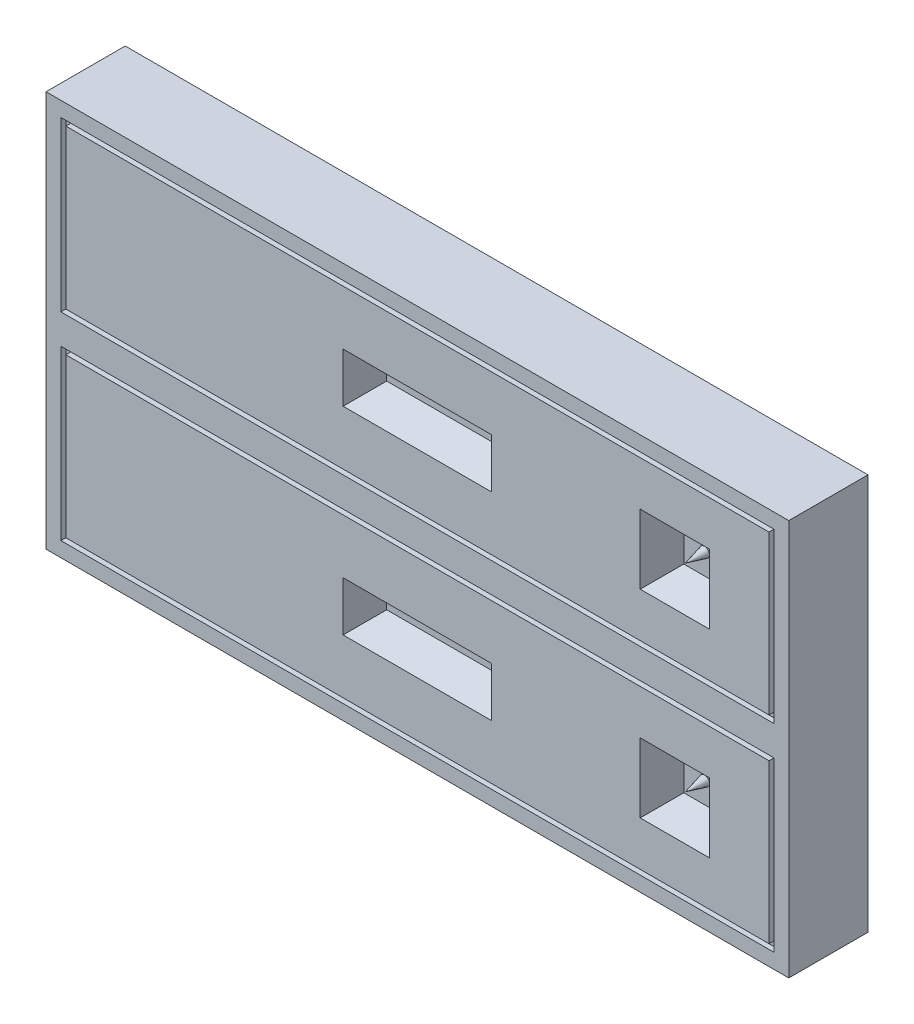
from build123d import *

# Parameters (mm, degrees)
SKETCH1_W                 = 75
SKETCH1_H                 = 40
BOSS_EXTRUDE1_DEPTH       = 8
SKETCH2_W                 = 72
SKETCH2_H                 = 17
SKETCH2_W_2               = 71
SKETCH2_H_2               = 16
CUT_EXTRUDE1_DEPTH        = 0.5
SKETCH3_W                 = 15
SKETCH3_H                 = 5
SKETCH3_W_2               = 7
SKETCH3_H_2               = 7
CUT_EXTRUDE3_DEPTH        = 3
DRAFT4_ANGLE              = 25
DRAFT5_ANGLE              = 25
DRAFT4_OF_MIRROR1_2_ANGLE = 25
DRAFT5_OF_MIRROR1_2_ANGLE = 25


with BuildPart() as part:
    # Sketch1 → Boss-Extrude1 (new body)
    with BuildSketch(Plane.XY):
        with Locations((37.5, 20)):
            Rectangle(SKETCH1_W, SKETCH1_H)
    extrude(amount=BOSS_EXTRUDE1_DEPTH)

    # Sketch2 → Cut-Extrude1 (cut)
    with BuildSketch(Plane.XY.offset(8)):
        with Locations((37.5, 10)):
            Rectangle(SKETCH2_W, SKETCH2_H)
        with Locations((37.5, 10)):
            Rectangle(SKETCH2_W_2, SKETCH2_H_2, mode=Mode.SUBTRACT)
    cut_extrude1 = extrude(amount=-CUT_EXTRUDE1_DEPTH, mode=Mode.SUBTRACT)

    # Sketch3 → Cut-Extrude3 (cut)
    with BuildSketch(Plane.XY.offset(8)):
        with Locations((37.5, 10)):
            Rectangle(SKETCH3_W, SKETCH3_H)
        with Locations((63.5, 10)):
            Rectangle(SKETCH3_W_2, SKETCH3_H_2)
    cut_extrude3 = extrude(amount=-CUT_EXTRUDE3_DEPTH, mode=Mode.SUBTRACT)

    # Draft4
    draft4_faces = [part.faces().sort_by_distance(p)[0] for p in [
        (45, 10, 6.5),
        (37.5, 7.5, 6.5),
        (30, 10, 6.5),
        (37.5, 12.5, 6.5),
    ]]
    draft(draft4_faces, Plane.XY.offset(8), DRAFT4_ANGLE)

    # Draft5
    draft5_faces = [part.faces().sort_by_distance(p)[0] for p in [
        (67, 10, 6.5),
        (63.5, 6.5, 6.5),
        (60, 10, 6.5),
        (63.5, 13.5, 6.5),
    ]]
    draft(draft5_faces, Plane.XY.offset(8), DRAFT5_ANGLE)

    # Sketch7 → Revolve2 (revolve)
    with BuildSketch(Plane(origin=(63.5, 0, 0), x_dir=(0, 0, -1), z_dir=(1, 0, 0)), mode=Mode.PRIVATE) as revolve2_sk:
        Polygon((-5, 10), (-5, 9.5), (-6.936491673, 10), align=None)
    revolve2 = revolve(revolve2_sk.sketch.rotate(Axis((63.5, 10, 6.936491673), (0, 0, -1)), 90), axis=Axis((63.5, 10, 6.936491673), (0, 0, -1)))

    # Mirror1: Cut-Extrude1, Cut-Extrude3, Revolve2 across plane
    add(cut_extrude1.mirror(Plane.ZX.offset(20)), mode=Mode.SUBTRACT)
    add(cut_extrude3.mirror(Plane.ZX.offset(20)), mode=Mode.SUBTRACT)
    add(revolve2.mirror(Plane.ZX.offset(20)))

    # Draft4 of Mirror1 2
    draft4_of_mirror1_2_faces = [part.faces().sort_by_distance(p)[0] for p in [
        (45, 30, 6.5),
        (37.5, 32.5, 6.5),
        (30, 30, 6.5),
        (37.5, 27.5, 6.5),
    ]]
    draft(draft4_of_mirror1_2_faces, Plane(origin=(0, 40, 8), x_dir=(1, 0, 0), z_dir=(0, 0, 1)), DRAFT4_OF_MIRROR1_2_ANGLE)

    # Draft5 of Mirror1 2
    draft5_of_mirror1_2_faces = [part.faces().sort_by_distance(p)[0] for p in [
        (67, 30, 6.5),
        (63.5, 33.5, 6.5),
        (60, 30, 6.5),
        (63.5, 26.5, 6.5),
    ]]
    draft(draft5_of_mirror1_2_faces, Plane(origin=(0, 40, 8), x_dir=(1, 0, 0), z_dir=(0, 0, 1)), DRAFT5_OF_MIRROR1_2_ANGLE)


solid = part.part
